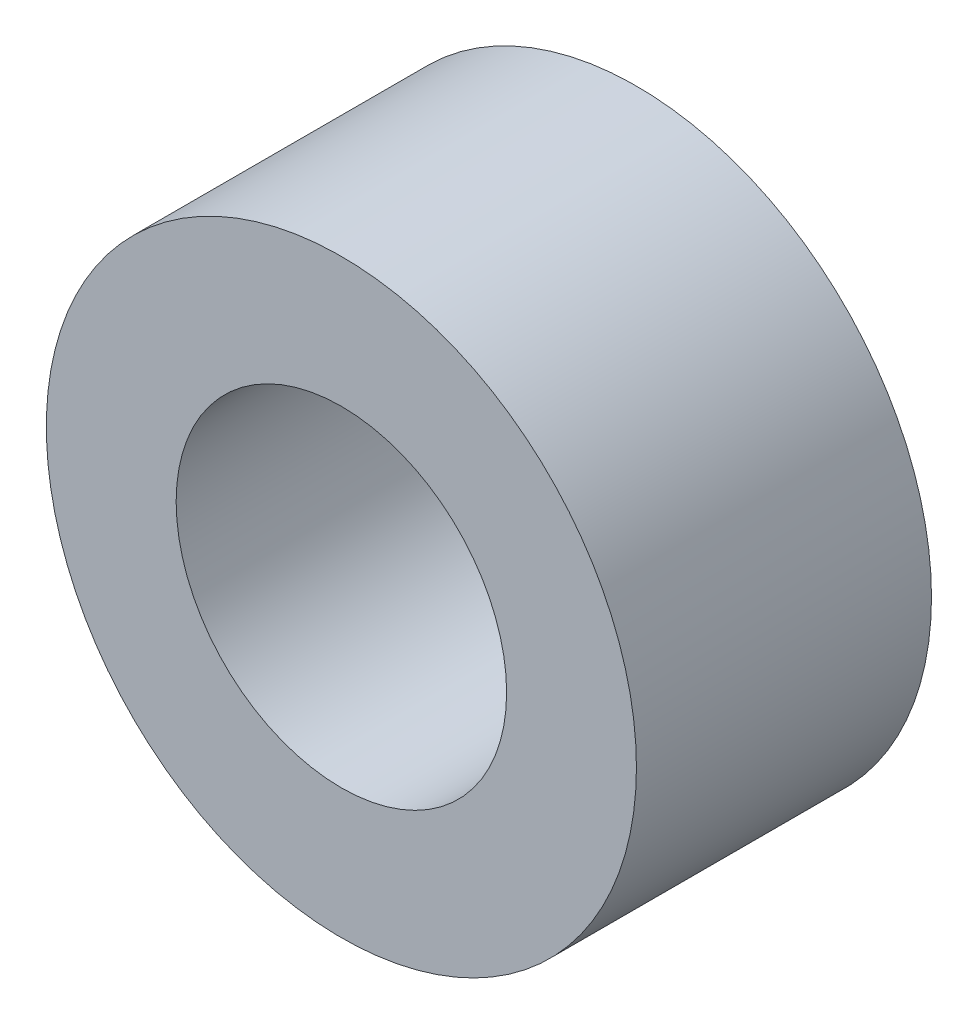
from build123d import *

# Parameters (mm, degrees)
SKETCH1_R      = 3.175
SKETCH1_R_2    = 1.778
EXTRUDE1_DEPTH = 1.5875


with BuildPart() as part:
    # Sketch1 → Extrude1 (new, symmetric)
    with BuildSketch(Plane.XY):
        Circle(SKETCH1_R)
        Circle(SKETCH1_R_2, mode=Mode.SUBTRACT)
    extrude(amount=EXTRUDE1_DEPTH, both=True)


solid = part.part
